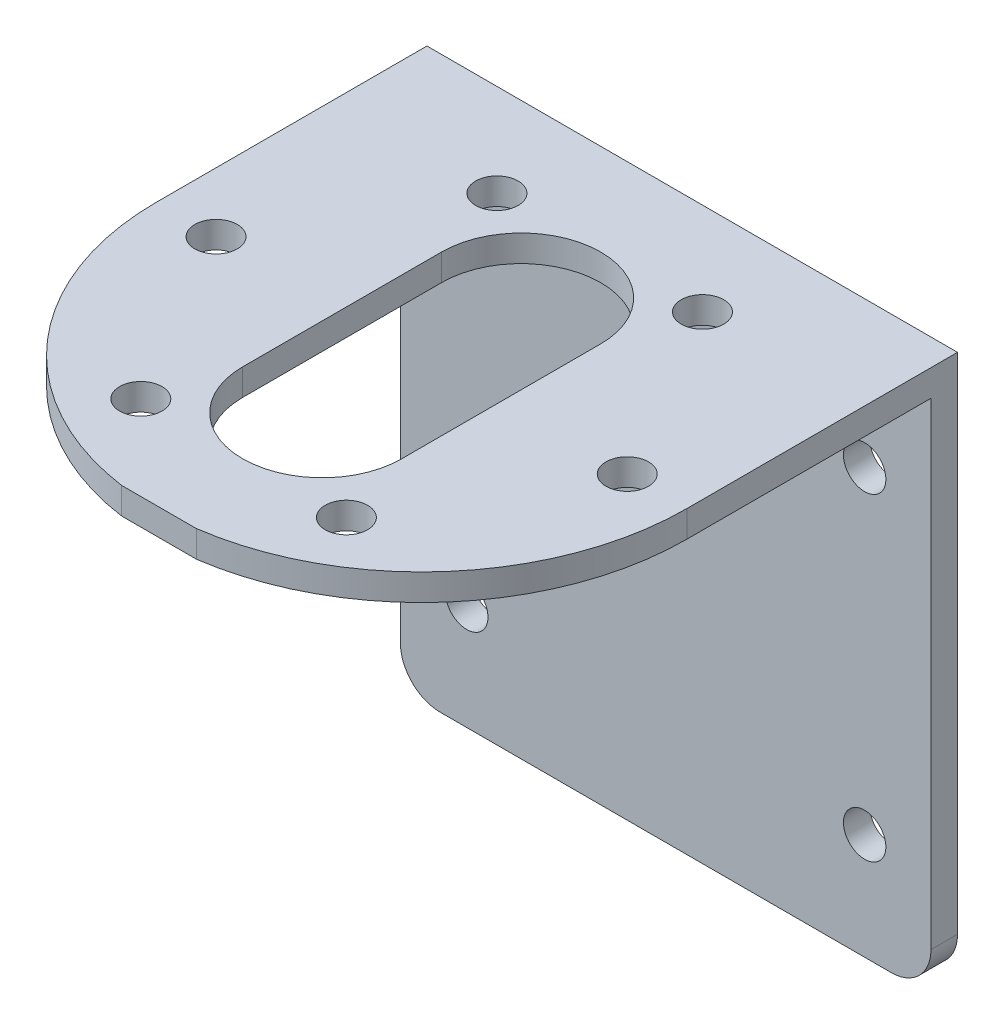
from build123d import *

# Parameters (mm, degrees)
SKETCH_2_W          = 40
SKETCH_2_H          = 41
SKETCH_2_R          = 1.6
EXTRUDE_1_DEPTH     = 40.2
SKETCH_3_W          = 40
SKETCH_3_H          = 39
CUT_EXTRUDE_1_DEPTH = 38.2
CUT_EXTRUDE_2_DEPTH = 60.604020905
SKETCH_5_R          = 1.6
CUT_EXTRUDE_3_DEPTH = 60.604020905
FILLET_1_R          = 3


with BuildPart() as part:
    # 草图2 → 凸台-拉伸1 (new body)
    with BuildSketch(Plane.XY):
        with Locations((0.386252919, 6.049930002)):
            Rectangle(SKETCH_2_W, SKETCH_2_H)
        with Locations(Location((-14.613747081, -6.450069998, 0), (0, 0, 180))):
            Circle(SKETCH_2_R, mode=Mode.SUBTRACT)
        with Locations(Location((15.386252919, -6.450069998, 0), (0, 0, 180))):
            Circle(SKETCH_2_R, mode=Mode.SUBTRACT)
        with Locations(Location((-14.613747081, 17.549930002, 0), (0, 0, 180))):
            Circle(SKETCH_2_R, mode=Mode.SUBTRACT)
        with Locations(Location((15.386252919, 17.549930002, 0), (0, 0, 180))):
            Circle(SKETCH_2_R, mode=Mode.SUBTRACT)
    extrude(amount=EXTRUDE_1_DEPTH)

    # 草图3 → 切除-拉伸1 (cut)
    with BuildSketch(Plane.XY.offset(40.2)):
        with Locations((0.386252919, 5.049930002)):
            Rectangle(SKETCH_3_W, SKETCH_3_H)
    extrude(amount=-CUT_EXTRUDE_1_DEPTH, mode=Mode.SUBTRACT)

    # 草图4 → 切除-拉伸2 (cut, through all)
    with BuildSketch(Plane.XZ.offset(-24.549930002)):
        with BuildLine():
            Line((-2.435094277, 40.2), (-19.613747081, 40.2))
            Line((-19.613747081, 40.2), (-19.613747081, 20.4))
            ThreePointArc((-19.613747081, 20.4), (-14.720483061, 33.50673598), (-2.435094277, 40.2))
        make_face()
        with BuildLine():
            Line((20.386252919, 40.2), (3.207600115, 40.2))
            ThreePointArc((3.207600115, 40.2), (15.492988899, 33.50673598), (20.386252919, 20.4))
            Line((20.386252919, 20.4), (20.386252919, 40.2))
        make_face()
    extrude(amount=-CUT_EXTRUDE_2_DEPTH, mode=Mode.SUBTRACT)

    # 草图5 → 切除-拉伸3 (cut, through all)
    with BuildSketch(Plane.XZ.offset(-24.549930002)):
        with Locations(Location((-15.113747081, 20.4, 0), (0, 0, 270))):
            Circle(SKETCH_5_R)
        with Locations(Location((15.886252919, 20.4, 0), (0, 0, 270))):
            Circle(SKETCH_5_R)
        with Locations(Location((-7.363747081, 33.823393759, 0), (0, 0, 270))):
            Circle(SKETCH_5_R)
        with Locations(Location((8.136252919, 33.823393759, 0), (0, 0, 270))):
            Circle(SKETCH_5_R)
        with Locations(Location((-7.363747081, 6.976606241, 0), (0, 0, 270))):
            Circle(SKETCH_5_R)
        with Locations(Location((8.136252919, 6.976606241, 0), (0, 0, 270))):
            Circle(SKETCH_5_R)
        with BuildLine():
            Line((-5.613747081, 12.9), (-5.613747081, 27.9))
            ThreePointArc((-5.613747081, 27.9), (0.386252919, 33.9), (6.386252919, 27.9))
            Line((6.386252919, 27.9), (6.386252919, 12.9))
            ThreePointArc((6.386252919, 12.9), (0.386252919, 6.9), (-5.613747081, 12.9))
        make_face()
    extrude(amount=-CUT_EXTRUDE_3_DEPTH, mode=Mode.SUBTRACT)

    # 圆角1
    fillet_1_edges = [part.edges().sort_by_distance(p)[0] for p in [
        (20.386252919, -14.450069998, 1),
        (-19.613747081, -14.450069998, 1),
    ]]
    fillet(fillet_1_edges, radius=FILLET_1_R)


solid = part.part
